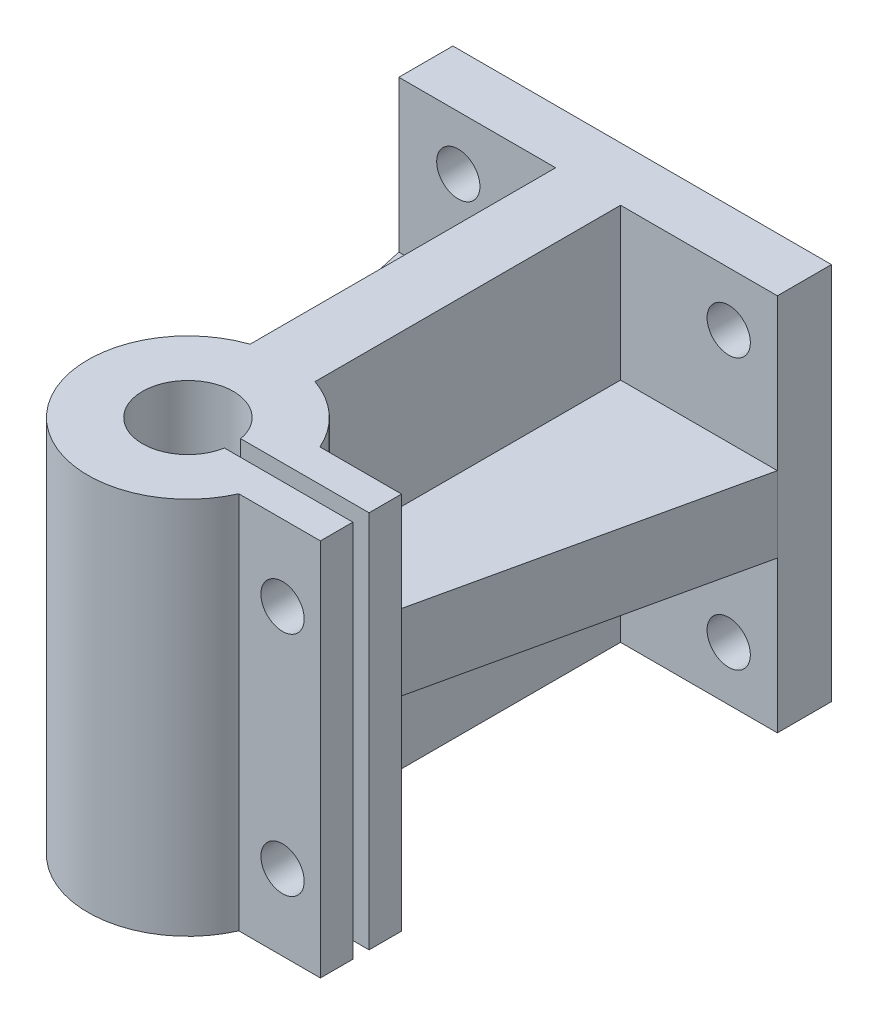
from build123d import *

# Parameters (mm, degrees)
SZKIC2_W                    = 35
SZKIC2_H                    = 5
DODANIE_WYCI_GNI_CIE1_DEPTH = 35
SZKIC3_R                    = 9.25
SZKIC3_R_2                  = 4.2
DODANIE_WYCI_GNI_CIE2_DEPTH = 35
SZKIC4_W                    = 6
SZKIC4_H                    = 30.71029356
DODANIE_WYCI_GNI_CIE3_DEPTH = 35
DODANIE_WYCI_GNI_CIE4_START = -14
DODANIE_WYCI_GNI_CIE4_DEPTH = 7
WYTNIJ_WYCI_GNI_CIE1_REACH  = 66.481
SZKIC7_R                    = 2
WYTNIJ_WYCI_GNI_CIE2_REACH  = 62.583
SZKIC8_W                    = 10.637888195
SZKIC8_H                    = 1.500000817
SZKIC11_W                   = 9.672485651
SZKIC11_H                   = 3
SZKIC11_H_2                 = 2.999999183
DODANIE_WYCI_GNI_CIE6_DEPTH = 35
SZKIC12_R                   = 2
WYTNIJ_WYCI_GNI_CIE4_DEPTH  = 12


with BuildPart() as part:
    # Szkic2 → Dodanie-wyciągnięcie1 (new body)
    with BuildSketch(Plane(origin=(0, 0, 0), x_dir=(1, 0, 0), z_dir=(0, 1, 0))):
        with Locations((0, 2.5)):
            Rectangle(SZKIC2_W, SZKIC2_H)
    extrude(amount=DODANIE_WYCI_GNI_CIE1_DEPTH)



with BuildPart() as body_2:
    # Szkic3 → Dodanie-wyciągnięcie2 (new body)
    with BuildSketch(Plane.XZ):
        with Locations(Location((0, 37, 0), (0, 0, 270))):
            Circle(SZKIC3_R)
        with Locations(Location((0, 37, 0), (0, 0, 270))):
            Circle(SZKIC3_R_2, mode=Mode.SUBTRACT)
    extrude(amount=-DODANIE_WYCI_GNI_CIE2_DEPTH)


with BuildPart() as part_1:
    add(part.part)

    add(body_2.part)  # Dodanie-wyciągnięcie3 merges body 2
    # Szkic4 → Dodanie-wyciągnięcie3 (add)
    with BuildSketch(Plane.XZ):
        with Locations((0, 15.35514678)):
            Rectangle(SZKIC4_W, SZKIC4_H)
    extrude(amount=-DODANIE_WYCI_GNI_CIE3_DEPTH)

    # Szkic5 → Dodanie-wyciągnięcie4 (add)
    with BuildSketch(Plane.XZ.offset(DODANIE_WYCI_GNI_CIE4_START)):
        Polygon((0, 0), (-17.5, 0), (-9.25, 37), (-3, 28.25), align=None)
        Polygon((3, 0), (3, 28.25), (9.25, 37), (17.5, 0), align=None)
    extrude(amount=-DODANIE_WYCI_GNI_CIE4_DEPTH)

    # Szkic7 → Wytnij-wyciągnięcie1 (cut, up to next)
    with BuildSketch(Plane(origin=(0, 0, -5), x_dir=(-1, 0, 0), z_dir=(0, 0, -1)), mode=Mode.PRIVATE) as wytnij_wyci_gni_cie1_sk1:
        with Locations((-13, 30)):
            Circle(SZKIC7_R)
    wytnij_wyci_gni_cie1_tool1 = extrude(wytnij_wyci_gni_cie1_sk1.sketch, amount=-WYTNIJ_WYCI_GNI_CIE1_REACH, mode=Mode.PRIVATE) & part_1.part
    # Szkic7 → Wytnij-wyciągnięcie1 (cut, up to next)
    with BuildSketch(Plane(origin=(0, 0, -5), x_dir=(-1, 0, 0), z_dir=(0, 0, -1)), mode=Mode.PRIVATE) as wytnij_wyci_gni_cie1_sk2:
        with Locations((12, 30)):
            Circle(SZKIC7_R)
    wytnij_wyci_gni_cie1_tool2 = extrude(wytnij_wyci_gni_cie1_sk2.sketch, amount=-WYTNIJ_WYCI_GNI_CIE1_REACH, mode=Mode.PRIVATE) & part_1.part
    # Szkic7 → Wytnij-wyciągnięcie1 (cut, up to next)
    with BuildSketch(Plane(origin=(0, 0, -5), x_dir=(-1, 0, 0), z_dir=(0, 0, -1)), mode=Mode.PRIVATE) as wytnij_wyci_gni_cie1_sk3:
        with Locations((12, 5)):
            Circle(SZKIC7_R)
    wytnij_wyci_gni_cie1_tool3 = extrude(wytnij_wyci_gni_cie1_sk3.sketch, amount=-WYTNIJ_WYCI_GNI_CIE1_REACH, mode=Mode.PRIVATE) & part_1.part
    # Szkic7 → Wytnij-wyciągnięcie1 (cut, up to next)
    with BuildSketch(Plane(origin=(0, 0, -5), x_dir=(-1, 0, 0), z_dir=(0, 0, -1)), mode=Mode.PRIVATE) as wytnij_wyci_gni_cie1_sk4:
        with Locations((-13, 5)):
            Circle(SZKIC7_R)
    wytnij_wyci_gni_cie1_tool4 = extrude(wytnij_wyci_gni_cie1_sk4.sketch, amount=-WYTNIJ_WYCI_GNI_CIE1_REACH, mode=Mode.PRIVATE) & part_1.part
    add(wytnij_wyci_gni_cie1_tool1.solids().sort_by_distance((13, 30, -5))[0], mode=Mode.SUBTRACT)
    add(wytnij_wyci_gni_cie1_tool2.solids().sort_by_distance((-12, 30, -5))[0], mode=Mode.SUBTRACT)
    add(wytnij_wyci_gni_cie1_tool3.solids().sort_by_distance((-12, 5, -5))[0], mode=Mode.SUBTRACT)
    add(wytnij_wyci_gni_cie1_tool4.solids().sort_by_distance((13, 5, -5))[0], mode=Mode.SUBTRACT)

    # Szkic8 → Wytnij-wyciągnięcie2 (cut, up to next)
    with BuildSketch(Plane.XZ, mode=Mode.PRIVATE) as wytnij_wyci_gni_cie2_sk1:
        with Locations((9.451437144, 37.000000409)):
            Rectangle(SZKIC8_W, SZKIC8_H)
    wytnij_wyci_gni_cie2_tool1 = extrude(wytnij_wyci_gni_cie2_sk1.sketch, amount=-WYTNIJ_WYCI_GNI_CIE2_REACH, mode=Mode.PRIVATE) & part_1.part
    add(wytnij_wyci_gni_cie2_tool1.solids().sort_by_distance((9.451437, 0, 37))[0], mode=Mode.SUBTRACT)

    # Szkic11 → Dodanie-wyciągnięcie6 (add)
    with BuildSketch(Plane(origin=(0, 0, 0), x_dir=(-1, 0, 0), z_dir=(0, -1, 0))):
        with Locations((-11.163757175, -34.75)):
            Rectangle(SZKIC11_W, SZKIC11_H)
        with Locations((-11.163757175, -39.250000409)):
            Rectangle(SZKIC11_W, SZKIC11_H_2)
    extrude(amount=-DODANIE_WYCI_GNI_CIE6_DEPTH)

    # Szkic12 → Wytnij-wyciągnięcie4 (cut)
    with BuildSketch(Plane.XY.offset(40.75)):
        with Locations((12.5, 28)):
            Circle(SZKIC12_R)
        with Locations((12.5, 7)):
            Circle(SZKIC12_R)
    extrude(amount=-WYTNIJ_WYCI_GNI_CIE4_DEPTH, mode=Mode.SUBTRACT)


solid = part_1.part
